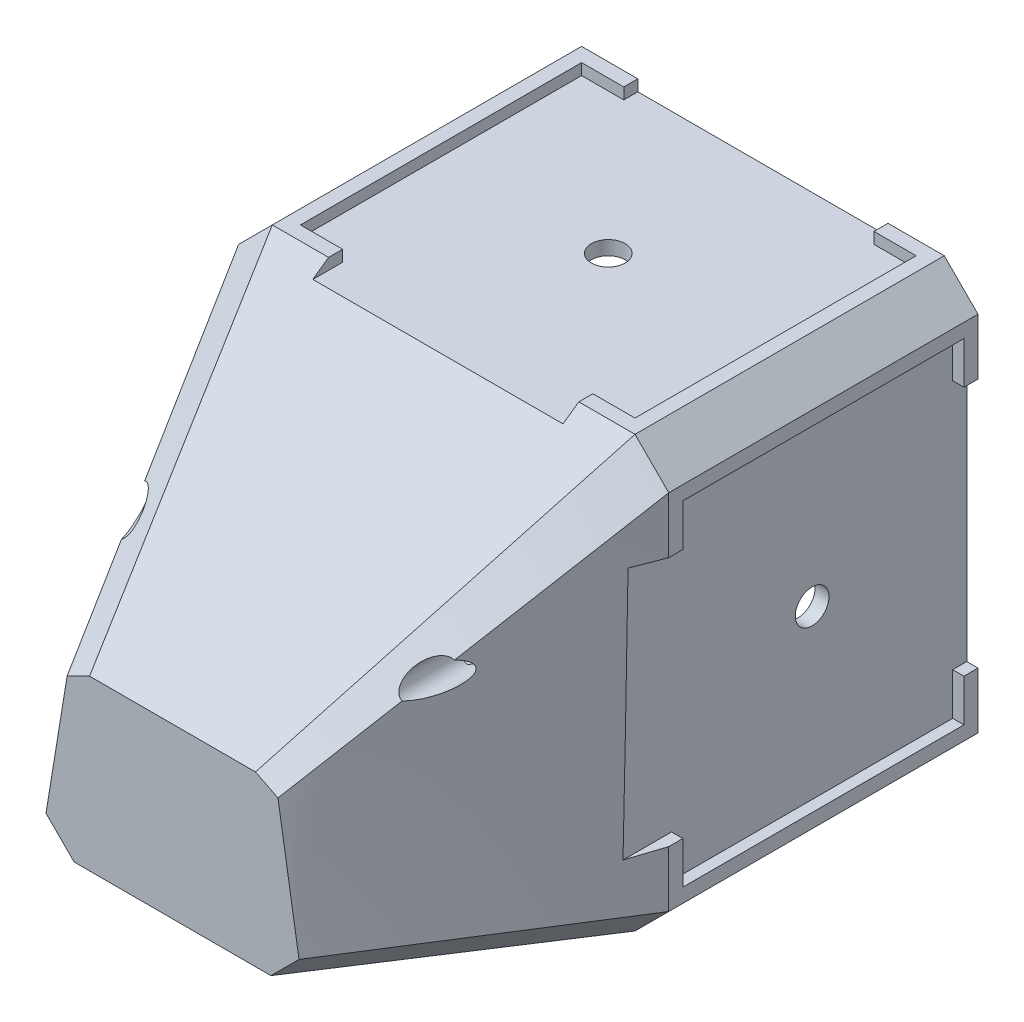
from build123d import *

# Parameters (mm, degrees)
CUT_EXTRUDE4_REACH  = 75.662
SKETCH6_W           = 44.5
SKETCH6_H           = 2
SKETCH6_W_2         = 2
SKETCH6_H_2         = 44.5
BOSS_EXTRUDE1_DEPTH = 55
BOSS_EXTRUDE2_DEPTH = 2.5
SKETCH11_R          = 1.65
CUT_EXTRUDE5_DEPTH  = 2.5
CUT_EXTRUDE6_DEPTH  = 6
CIRPATTERN1_COUNT   = 4
CUT_EXTRUDE7_REACH  = 102.191
SKETCH13_R          = 3
CIRPATTERN2_COUNT   = 4
SKETCH14_W          = 59.5
SKETCH14_H          = 50
CUT_EXTRUDE8_DEPTH  = 2
CIRPATTERN3_COUNT   = 4
CUT_EXTRUDE9_REACH  = 120.115
SKETCH16_R          = 2.5


with BuildPart() as part:
    # Sketch2 → Loft2 section 0
    with BuildSketch(Plane.XY.offset(50)):
        with BuildLine():
            Line((-17.5, -27.5), (17.5, -27.5))
            Line((17.5, -27.5), (22.5, -22.5))
            Line((22.5, -22.5), (18.75, 0.5))
            Line((18.75, 0.5), (14.75, 2.5))
            Line((14.75, 2.5), (-14.75, 2.5))
            Line((-14.75, 2.5), (-18.75, 0.5))
            Line((-18.75, 0.5), (-22.5, -22.5))
            Line((-22.5, -22.5), (-17.5, -27.5))
        make_face()
    # Sketch1 → Loft2 section 1
    with BuildSketch(Plane.XY):
        with BuildLine():
            Line((38.25, 32.25), (32.25, 38.25))
            Line((32.25, 38.25), (-32.25, 38.25))
            Line((-32.25, 38.25), (-38.25, 32.25))
            Line((-38.25, 32.25), (-38.25, -32.25))
            Line((-38.25, -32.25), (-32.25, -38.25))
            Line((-32.25, -38.25), (32.25, -38.25))
            Line((32.25, -38.25), (38.25, -32.25))
            Line((38.25, -32.25), (38.25, 32.25))
        make_face()
    loft()

    # Sketch6 → Cut-Extrude4 (cut, up to next)
    with BuildSketch(Plane(origin=(0, 0, 0), x_dir=(-1, 0, 0), z_dir=(0, 0, -1)), mode=Mode.PRIVATE) as cut_extrude4_sk1:
        with Locations((0, 37.25)):
            Rectangle(SKETCH6_W, SKETCH6_H)
    cut_extrude4_tool1 = extrude(cut_extrude4_sk1.sketch, amount=-CUT_EXTRUDE4_REACH, mode=Mode.PRIVATE) & part.part
    # Sketch6 → Cut-Extrude4 (cut, up to next)
    with BuildSketch(Plane(origin=(0, 0, 0), x_dir=(-1, 0, 0), z_dir=(0, 0, -1)), mode=Mode.PRIVATE) as cut_extrude4_sk2:
        with Locations((37.25, 0)):
            Rectangle(SKETCH6_W_2, SKETCH6_H_2)
    cut_extrude4_tool2 = extrude(cut_extrude4_sk2.sketch, amount=-CUT_EXTRUDE4_REACH, mode=Mode.PRIVATE) & part.part
    # Sketch6 → Cut-Extrude4 (cut, up to next)
    with BuildSketch(Plane(origin=(0, 0, 0), x_dir=(-1, 0, 0), z_dir=(0, 0, -1)), mode=Mode.PRIVATE) as cut_extrude4_sk3:
        with Locations((0, -37.25)):
            Rectangle(SKETCH6_W, SKETCH6_H)
    cut_extrude4_tool3 = extrude(cut_extrude4_sk3.sketch, amount=-CUT_EXTRUDE4_REACH, mode=Mode.PRIVATE) & part.part
    # Sketch6 → Cut-Extrude4 (cut, up to next)
    with BuildSketch(Plane(origin=(0, 0, 0), x_dir=(-1, 0, 0), z_dir=(0, 0, -1)), mode=Mode.PRIVATE) as cut_extrude4_sk4:
        with Locations((-37.25, 0)):
            Rectangle(SKETCH6_W_2, SKETCH6_H_2)
    cut_extrude4_tool4 = extrude(cut_extrude4_sk4.sketch, amount=-CUT_EXTRUDE4_REACH, mode=Mode.PRIVATE) & part.part
    add(cut_extrude4_tool1.solids().sort_by_distance((0, 37.25, 0))[0], mode=Mode.SUBTRACT)
    add(cut_extrude4_tool2.solids().sort_by_distance((-37.25, 0, 0))[0], mode=Mode.SUBTRACT)
    add(cut_extrude4_tool3.solids().sort_by_distance((0, -37.25, 0))[0], mode=Mode.SUBTRACT)
    add(cut_extrude4_tool4.solids().sort_by_distance((37.25, 0, 0))[0], mode=Mode.SUBTRACT)

    # Sketch7 → Cut-Loft2 section 0
    with BuildSketch(Plane(origin=(0, 0, 0), x_dir=(-1, 0, 0), z_dir=(0, 0, -1))):
        with BuildLine():
            Line((-33.75, 22.25), (-22.25, 33.75))
            Line((-22.25, 33.75), (22.25, 33.75))
            Line((22.25, 33.75), (33.75, 22.25))
            Line((33.75, 22.25), (33.75, -22.25))
            Line((33.75, -22.25), (22.25, -33.75))
            Line((22.25, -33.75), (-22.25, -33.75))
            Line((-22.25, -33.75), (-33.75, -22.25))
            Line((-33.75, -22.25), (-33.75, 22.25))
        make_face()
    # Sketch8 → Cut-Loft2 section 1
    with BuildSketch(Plane.XY.offset(45)):
        with BuildLine():
            Line((-14.159830056, 0), (-16.488334442, -1.164252193))
            Line((-16.488334442, -1.164252193), (-19.826448385, -21.638017709))
            Line((-19.826448385, -21.638017709), (-16.464466094, -25))
            Line((-16.464466094, -25), (16.464466094, -25))
            Line((16.464466094, -25), (19.826448385, -21.638017709))
            Line((19.826448385, -21.638017709), (16.488334442, -1.164252193))
            Line((16.488334442, -1.164252193), (14.159830056, 0))
            Line((14.159830056, 0), (-14.159830056, 0))
        make_face()
    loft(mode=Mode.SUBTRACT)

    # Sketch9 → Boss-Extrude1 (add)
    with BuildSketch(Plane(origin=(0, 0, 0), x_dir=(-1, 0, 0), z_dir=(0, 0, -1))):
        Polygon((22.25, 36.25), (-22.25, 36.25), (-22.25, 38.25), (-32.25, 38.25), (-38.25, 32.25), (-38.25, 22.25), (-36.25, 22.25), (-36.25, -22.25), (-38.25, -22.25), (-38.25, -32.25), (-32.25, -38.25), (-22.25, -38.25), (-22.25, -36.25), (22.25, -36.25), (22.25, -38.25), (32.25, -38.25), (38.25, -32.25), (38.25, -22.25), (36.25, -22.25), (36.25, 22.25), (38.25, 22.25), (38.25, 32.25), (32.25, 38.25), (22.25, 38.25), align=None)
        Polygon((22.25, 33.75), (-22.25, 33.75), (-33.75, 22.25), (-33.75, -22.25), (-22.25, -33.75), (22.25, -33.75), (33.75, -22.25), (33.75, 22.25), align=None, mode=Mode.SUBTRACT)
    extrude(amount=BOSS_EXTRUDE1_DEPTH)

    # Sketch10 → Boss-Extrude2 (add)
    with BuildSketch(Plane(origin=(0, 0, -55), x_dir=(-1, 0, 0), z_dir=(0, 0, -1))):
        with BuildLine():
            Line((-38.25, 32.25), (-32.25, 38.25))
            Line((-32.25, 38.25), (-22.25, 38.25))
            Line((-22.25, 38.25), (-22.25, 26.25))
            ThreePointArc((-22.25, 26.25), (-23.421572875, 23.421572875), (-26.25, 22.25))
            Line((-26.25, 22.25), (-38.25, 22.25))
            Line((-38.25, 22.25), (-38.25, 32.25))
        make_face()
        with BuildLine():
            Line((32.25, 38.25), (38.25, 32.25))
            Line((38.25, 32.25), (38.25, 22.25))
            Line((38.25, 22.25), (26.25, 22.25))
            ThreePointArc((26.25, 22.25), (23.421572875, 23.421572875), (22.25, 26.25))
            Line((22.25, 26.25), (22.25, 38.25))
            Line((22.25, 38.25), (32.25, 38.25))
        make_face()
        with BuildLine():
            Line((38.25, -32.25), (32.25, -38.25))
            Line((32.25, -38.25), (22.25, -38.25))
            Line((22.25, -38.25), (22.25, -26.25))
            ThreePointArc((22.25, -26.25), (23.421572875, -23.421572875), (26.25, -22.25))
            Line((26.25, -22.25), (38.25, -22.25))
            Line((38.25, -22.25), (38.25, -32.25))
        make_face()
        with BuildLine():
            Line((-32.25, -38.25), (-38.25, -32.25))
            Line((-38.25, -32.25), (-38.25, -22.25))
            Line((-38.25, -22.25), (-26.25, -22.25))
            ThreePointArc((-26.25, -22.25), (-23.421572875, -23.421572875), (-22.25, -26.25))
            Line((-22.25, -26.25), (-22.25, -38.25))
            Line((-22.25, -38.25), (-32.25, -38.25))
        make_face()
    extrude(amount=-BOSS_EXTRUDE2_DEPTH)

    # Sketch11 → Cut-Extrude5 (cut)
    with BuildSketch(Plane(origin=(0, 0, -55), x_dir=(-1, 0, 0), z_dir=(0, 0, -1))):
        with Locations((-28.75, 28.75)):
            Circle(SKETCH11_R)
        with Locations((28.75, 28.75)):
            Circle(SKETCH11_R)
        with Locations((28.75, -28.75)):
            Circle(SKETCH11_R)
        with Locations((-28.75, -28.75)):
            Circle(SKETCH11_R)
    extrude(amount=-CUT_EXTRUDE5_DEPTH, mode=Mode.SUBTRACT)

    # Sketch12 → Cut-Extrude6 (cut)
    with BuildSketch(Plane.XY.offset(-52.5)):
        Polygon((-27.090117976, 31.625), (-30.409882024, 31.625), (-32.069764048, 28.75), (-30.409882024, 25.875), (-30.125, 25.875), (-26.096315823, 29.903684177), align=None)
    cut_extrude6 = extrude(amount=CUT_EXTRUDE6_DEPTH, mode=Mode.SUBTRACT)

    # CirPattern1: Cut-Extrude6 ×4 about axis
    cirpattern1_axis = Axis((0, 0, 52.50011), (0, 0, -1))
    for i in range(1, CIRPATTERN1_COUNT):
        add(cut_extrude6.rotate(cirpattern1_axis, i * 360 / CIRPATTERN1_COUNT), mode=Mode.SUBTRACT)

    # Sketch13 → Cut-Extrude7 (cut, up to next)
    with BuildSketch(Plane(origin=(0, 36.25, 0), x_dir=(1, 0, 0), z_dir=(0, 1, 0)), mode=Mode.PRIVATE) as cut_extrude7_sk1:
        with Locations((0, 27.5)):
            Circle(SKETCH13_R)
    cut_extrude7_tool1 = extrude(cut_extrude7_sk1.sketch, amount=-CUT_EXTRUDE7_REACH, mode=Mode.PRIVATE) & part.part
    cut_extrude7 = cut_extrude7_tool1.solids().sort_by_distance((0, 36.25, -27.5))[0]
    add(cut_extrude7, mode=Mode.SUBTRACT)

    # CirPattern2: Cut-Extrude7 ×4 about axis
    cirpattern2_axis = Axis((0, 0, 52.50011), (0, 0, -1))
    for i in range(1, CIRPATTERN2_COUNT):
        add(cut_extrude7.rotate(cirpattern2_axis, i * 360 / CIRPATTERN2_COUNT), mode=Mode.SUBTRACT)

    # Sketch14 → Cut-Extrude8 (cut)
    with BuildSketch(Plane(origin=(0, 38.25, 0), x_dir=(1, 0, 0), z_dir=(0, 1, 0))):
        with Locations((0, 27.5)):
            Rectangle(SKETCH14_W, SKETCH14_H)
    cut_extrude8 = extrude(amount=-CUT_EXTRUDE8_DEPTH, mode=Mode.SUBTRACT)

    # CirPattern3: Cut-Extrude8 ×4 about axis
    cirpattern3_axis = Axis((0, 0, 52.50011), (0, 0, -1))
    for i in range(1, CIRPATTERN3_COUNT):
        add(cut_extrude8.rotate(cirpattern3_axis, i * 360 / CIRPATTERN3_COUNT), mode=Mode.SUBTRACT)

    # Sketch16 → Cut-Extrude9 (cut, up to next)
    with BuildSketch(Plane.XY.offset(50), mode=Mode.PRIVATE) as cut_extrude9_sk1:
        with Locations((-26.25, 12.711538462)):
            Circle(SKETCH16_R)
    cut_extrude9_tool1 = extrude(cut_extrude9_sk1.sketch, amount=-CUT_EXTRUDE9_REACH, mode=Mode.PRIVATE) & part.part
    cut_extrude9 = cut_extrude9_tool1.solids().sort_by_distance((-26.25, 12.711538, 50))[0]
    add(cut_extrude9, mode=Mode.SUBTRACT)

    # Mirror1: Cut-Extrude9 across plane
    add(cut_extrude9.mirror(Plane(origin=(0, 0, 0), x_dir=(0, 0, 1), z_dir=(1, 0, 0))), mode=Mode.SUBTRACT)


solid = part.part
